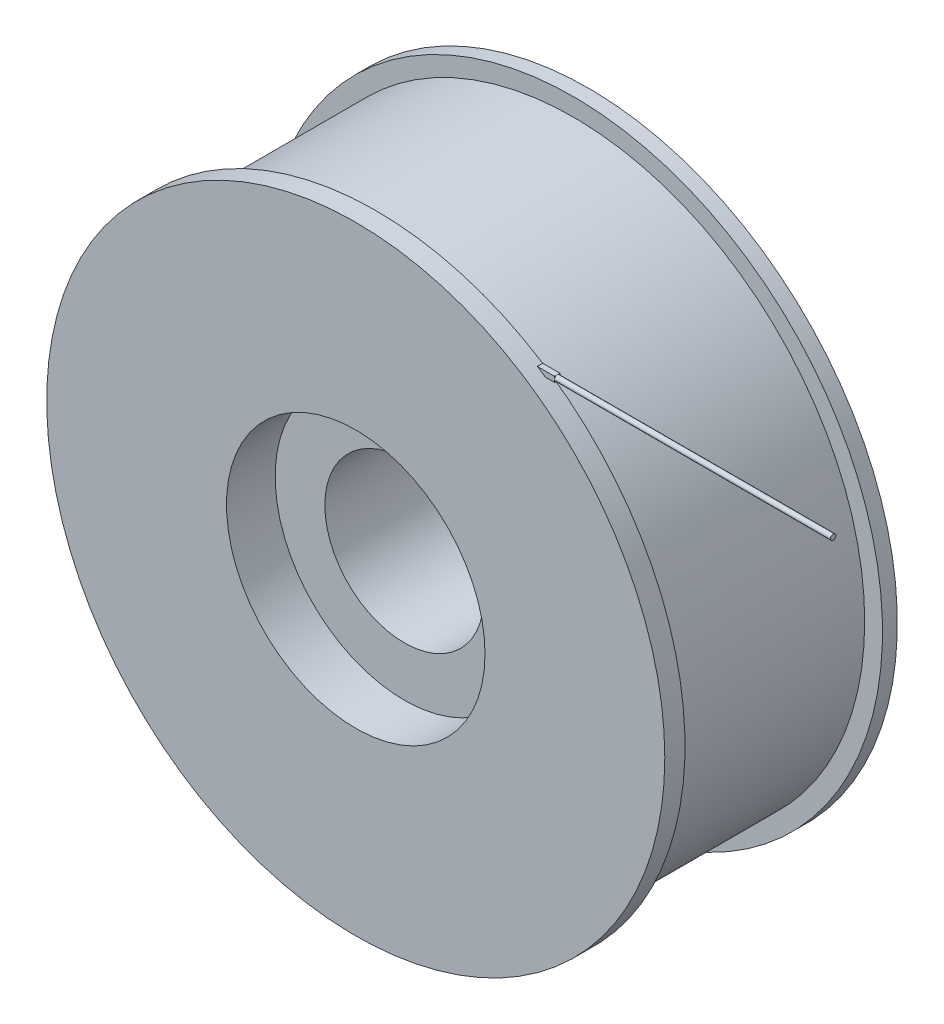
from build123d import *
from build123d.topology import SkipClean

# Parameters (mm, degrees)
SKETCH1_R           = 100.8
SKETCH1_R_2         = 25.95
BOSS_EXTRUDE1_DEPTH = 4.84
SKETCH2_R           = 45.11
SKETCH2_R_2         = 25.95
BOSS_EXTRUDE2_DEPTH = 66.17
SKETCH3_R           = 100.8
SKETCH3_R_2         = 25.95
BOSS_EXTRUDE3_DEPTH = 4.84
SKETCH4_R           = 42.16
CUT_EXTRUDE1_DEPTH  = 15.86
BOSS_EXTRUDE4_START = 66.17
SKETCH5_R           = 95
SKETCH5_R_2         = 45.11
BOSS_EXTRUDE4_DEPTH = 66.17
BOSS_EXTRUDE6_START = 1.75
BOSS_EXTRUDE6_DEPTH = 1.75
SKETCH9_W           = 1.947145626
SKETCH9_H           = 1.958948438
CUT_EXTRUDE6_DEPTH  = 90


with BuildPart() as part:
    # Sketch1 → Boss-Extrude1 (new body)
    with BuildSketch(Plane.XY):
        with Locations(Location((0, 0, 0), (0, 0, 180))):
            Circle(SKETCH1_R)
        with Locations(Location((0, 0, 0), (0, 0, 180))):
            Circle(SKETCH1_R_2, mode=Mode.SUBTRACT)
    extrude(amount=BOSS_EXTRUDE1_DEPTH)

    # Sketch2 → Boss-Extrude2 (add)
    with BuildSketch(Plane.XY.offset(4.84)):
        Circle(SKETCH2_R)
        with Locations(Location((0, 0, 0), (0, 0, 180))):
            Circle(SKETCH2_R_2, mode=Mode.SUBTRACT)
    extrude(amount=BOSS_EXTRUDE2_DEPTH)

    # Sketch3 → Boss-Extrude3 (add)
    with BuildSketch(Plane.XY.offset(71.01)):
        with Locations(Location((0, 0, 0), (0, 0, 180))):
            Circle(SKETCH3_R)
        with Locations(Location((0, 0, 0), (0, 0, 180))):
            Circle(SKETCH3_R_2, mode=Mode.SUBTRACT)
    extrude(amount=BOSS_EXTRUDE3_DEPTH)

    # Sketch4 → Cut-Extrude1 (cut)
    with BuildSketch(Plane.XY.offset(75.85)):
        Circle(SKETCH4_R)
    extrude(amount=-CUT_EXTRUDE1_DEPTH, mode=Mode.SUBTRACT)

    # Sketch5 → Boss-Extrude4 (add)
    with BuildSketch(Plane(origin=(0, 0, 71.01), x_dir=(-1, 0, 0), z_dir=(0, 0, -1)).offset(BOSS_EXTRUDE4_START)):
        with Locations(Location((0, 0, 0), (0, 0, 180))):
            Circle(SKETCH5_R)
        Circle(SKETCH5_R_2, mode=Mode.SUBTRACT)
    extrude(amount=-BOSS_EXTRUDE4_DEPTH)

    # Sketch8 → Boss-Extrude6 (add)
    with SkipClean():  # the faces are left unmerged after this step: merging them gives an invalid solid
        with BuildSketch(Plane(origin=(0, 0, 71.01), x_dir=(-1, 0, 0), z_dir=(0, 0, -1)).offset(BOSS_EXTRUDE6_START)):
            with BuildLine():
                Line((-54.384952882, 84.87), (-42.685865342, 84.87))
                ThreePointArc((-42.685865342, 84.87), (44.35192128, -84.011350893), (-46.000713038, 83.12))
                Line((-46.000713038, 83.12), (-57.023728394, 83.12))
                ThreePointArc((-57.023728394, 83.12), (55.711212435, -84.005361788), (-54.384952882, 84.87))
            make_face()
            with BuildLine():
                ThreePointArc((-57.023728394, 83.12), (-55.711212435, 84.005361788), (-54.384952882, 84.87))
                Line((-54.384952882, 84.87), (-150, 84.87))
                Line((-150, 84.87), (-150, 83.12))
                Line((-150, 83.12), (-57.023728394, 83.12))
            make_face()
        extrude(amount=-BOSS_EXTRUDE6_DEPTH)


with BuildPart() as boss_extrude6_piece_1:
    # of the separate pieces the step leaves, piece 1, a body of its own (boss_extrude6_pieces)
    add(part.part.solids().sort_by_distance((-100.8, 0, 0))[0])


with BuildPart() as boss_extrude6_piece_2:
    # of the separate pieces the step leaves, piece 2, a body of its own (boss_extrude6_pieces)
    add(part.part.solids().sort_by_distance((150, 83.12, 69.26))[0])

    # Sketch9 → Cut-Extrude6 (cut)
    # profile 1 of 5: a face of its own
    with BuildSketch(Plane(origin=(150, 0, 0), x_dir=(0, 0, -1), z_dir=(1, 0, 0))):
        with Locations((-70.135, 83.995)):
            Rectangle(SKETCH9_W, SKETCH9_H)
        Polygon((-69.26, 83.995), (-69.26, 83.12), (-70.135, 83.12), (-71.01, 83.12), (-71.01, 83.995), (-71.01, 84.87), (-70.135, 84.87), (-69.26, 84.87), align=None, mode=Mode.SUBTRACT)
    # profile 2 of 5: a face of its own
    with BuildSketch(Plane(origin=(150, 0, 0), x_dir=(0, 0, -1), z_dir=(1, 0, 0))):
        with BuildLine():
            Line((-71.01, 83.12), (-70.135, 83.12))
            ThreePointArc((-70.135, 83.12), (-70.753718434, 83.376281566), (-71.01, 83.995))
            Line((-71.01, 83.995), (-71.01, 83.12))
        make_face()
    # profile 3 of 5: a face of its own
    with BuildSketch(Plane(origin=(150, 0, 0), x_dir=(0, 0, -1), z_dir=(1, 0, 0))):
        with BuildLine():
            Line((-70.135, 83.12), (-69.26, 83.12))
            Line((-69.26, 83.12), (-69.26, 83.995))
            ThreePointArc((-69.26, 83.995), (-69.516281566, 83.376281566), (-70.135, 83.12))
        make_face()
    # profile 4 of 5: a face of its own
    with BuildSketch(Plane(origin=(150, 0, 0), x_dir=(0, 0, -1), z_dir=(1, 0, 0))):
        with BuildLine():
            ThreePointArc((-70.135, 84.87), (-69.516281566, 84.613718434), (-69.26, 83.995))
            Line((-69.26, 83.995), (-69.26, 84.87))
            Line((-69.26, 84.87), (-70.135, 84.87))
        make_face()
    # profile 5 of 5: a face of its own
    with BuildSketch(Plane(origin=(150, 0, 0), x_dir=(0, 0, -1), z_dir=(1, 0, 0))):
        with BuildLine():
            ThreePointArc((-71.01, 83.995), (-70.753718434, 84.613718434), (-70.135, 84.87))
            Line((-70.135, 84.87), (-71.01, 84.87))
            Line((-71.01, 84.87), (-71.01, 83.995))
        make_face()
    extrude(amount=-CUT_EXTRUDE6_DEPTH, mode=Mode.SUBTRACT)


solid = Compound([boss_extrude6_piece_1.part, boss_extrude6_piece_2.part])
